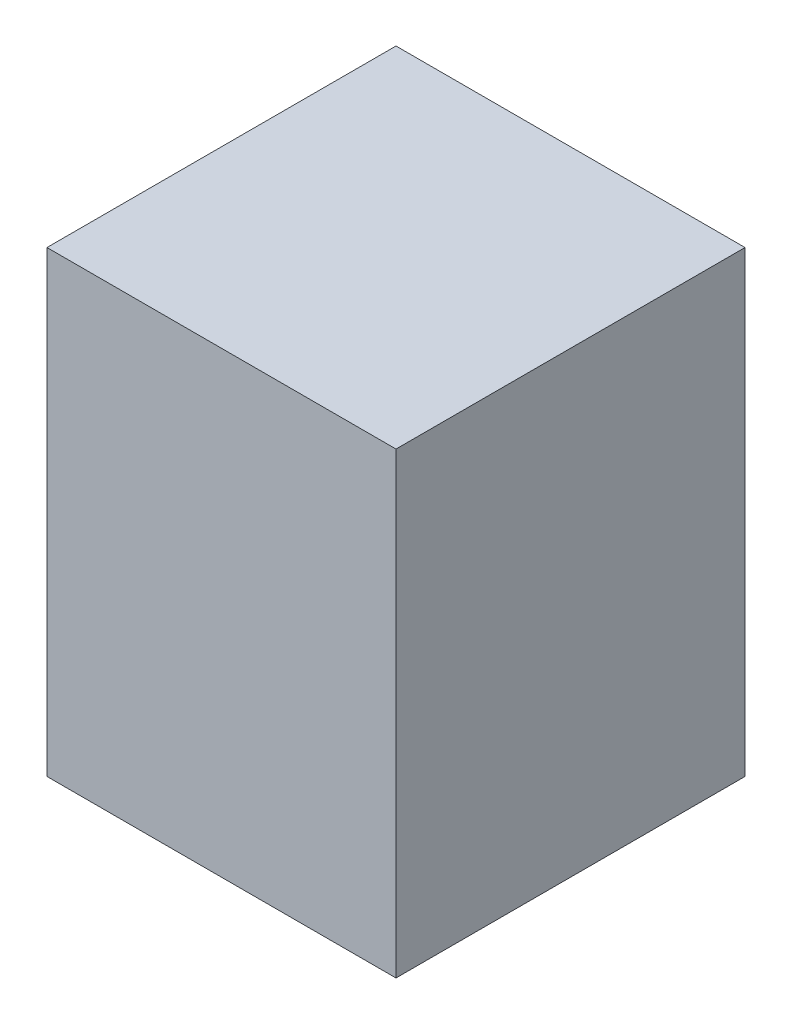
from build123d import *

# Parameters (mm, degrees)
SKETCH1_W           = 16
SKETCH1_H           = 16
BOSS_EXTRUDE1_DEPTH = 21


with BuildPart() as part:
    # Sketch1 → Boss-Extrude1 (new body)
    with BuildSketch(Plane(origin=(0, 0, 0), x_dir=(1, 0, 0), z_dir=(0, 1, 0))):
        Rectangle(SKETCH1_W, SKETCH1_H)
    extrude(amount=BOSS_EXTRUDE1_DEPTH)


solid = part.part
